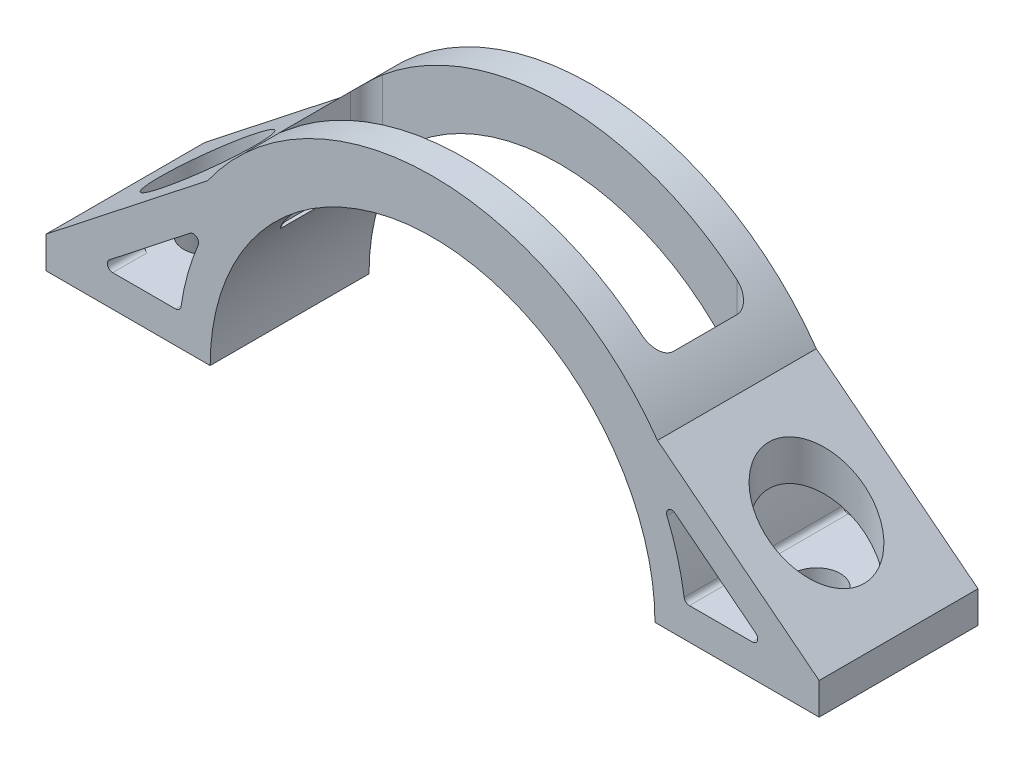
from build123d import *

# Parameters (mm, degrees)
SALIENTE_EXTRUIR1_DEPTH = 7.5
SALIENTE_EXTRUIR2_DEPTH = 7.5
CROQUIS3_R              = 2.25
CORTAR_EXTRUIR1_DEPTH   = 46.436769251
CROQUIS4_R              = 4.5
CORTAR_EXTRUIR2_DEPTH   = 44.789268092
CORTAR_EXTRUIR3_DEPTH   = 48.257274572
CORTAR_EXTRUIR4_DEPTH   = 15


with BuildPart() as part:
    # Croquis1 → Saliente-Extruir1 (new, symmetric)
    with BuildSketch(Plane.XY):
        with BuildLine():
            Line((-26, 0), (-21, 0))
            ThreePointArc((-21, 0), (0, 21), (21, 0))
            Line((21, 0), (26, 0))
            ThreePointArc((26, 0), (0, 26), (-26, 0))
        make_face()
    extrude(amount=SALIENTE_EXTRUIR1_DEPTH, both=True)

    # Croquis2 → Saliente-Extruir2 (add, symmetric)
    with BuildSketch(Plane.XY):
        with BuildLine():
            Line((26, 0), (36.5, 0))
            Line((36.5, 0), (36.5, 3))
            Line((36.5, 3), (21.236760582, 15))
            ThreePointArc((21.236760582, 15), (24.78059498, 7.869060455), (26, 0))
        make_face()
    saliente_extruir2 = extrude(amount=SALIENTE_EXTRUIR2_DEPTH, both=True)

    # Croquis3 → Cortar-Extruir1 (cut, through all)
    with BuildSketch(Plane.XZ):
        with Locations(Location((28.75, 0, 0), (0, 0, 270))):
            Circle(CROQUIS3_R)
    cortar_extruir1 = extrude(amount=-CORTAR_EXTRUIR1_DEPTH, mode=Mode.SUBTRACT)

    # Croquis4 → Cortar-Extruir2 (cut, through all)
    with BuildSketch(Plane(origin=(0, 3, 0), x_dir=(-1, 0, 0), z_dir=(0, -1, 0))):
        with Locations(Location((-28.75, 0, 0), (0, 0, 90))):
            Circle(CROQUIS4_R)
    cortar_extruir2 = extrude(amount=-CORTAR_EXTRUIR2_DEPTH, mode=Mode.SUBTRACT)

    # Simetría1: Saliente-Extruir2 across plane
    add(saliente_extruir2.mirror(Plane(origin=(0, 0, 0), x_dir=(0, 0, 1), z_dir=(1, 0, 0))))

    # Croquis6 → Cortar-Extruir3 (cut, through all)
    with BuildSketch(Plane.XY.offset(7.5)):
        with BuildLine():
            Line((30.510170652, 3.893065888), (22.898948379, 9.877029369))
            ThreePointArc((22.898948379, 9.877029369), (22.28692582, 9.881701061), (22.128900164, 9.290413206))
            ThreePointArc((22.128900164, 9.290413206), (23.12783497, 6.411181608), (23.753839647, 3.428571429))
            ThreePointArc((23.753839647, 3.428571429), (23.921384471, 3.122035527), (24.248711306, 3))
            Line((24.248711306, 3), (30.201141191, 3))
            ThreePointArc((30.201141191, 3), (30.673652007, 3.336496092), (30.510170652, 3.893065888))
        make_face()
    cortar_extruir3 = extrude(amount=-CORTAR_EXTRUIR3_DEPTH, mode=Mode.SUBTRACT)

    # Croquis8 → Cortar-Extruir4 (cut)
    with BuildSketch(Plane(origin=(0, 26, 0), x_dir=(1, 0, 0), z_dir=(0, 1, 0))):
        with BuildLine():
            Line((-16.736760582, -4.5), (16.736760582, -4.5))
            ThreePointArc((16.736760582, -4.5), (17.797420753, -4.060660172), (18.236760582, -3))
            Line((18.236760582, -3), (18.236760582, 3))
            ThreePointArc((18.236760582, 3), (17.797420753, 4.060660172), (16.736760582, 4.5))
            Line((16.736760582, 4.5), (-16.736760582, 4.5))
            ThreePointArc((-16.736760582, 4.5), (-17.797420753, 4.060660172), (-18.236760582, 3))
            Line((-18.236760582, 3), (-18.236760582, -3))
            ThreePointArc((-18.236760582, -3), (-17.797420753, -4.060660172), (-16.736760582, -4.5))
        make_face()
    extrude(amount=-CORTAR_EXTRUIR4_DEPTH, mode=Mode.SUBTRACT)

    # Simetría2: Cortar-Extruir1, Cortar-Extruir2, Cortar-Extruir3 across plane
    add(cortar_extruir1.mirror(Plane(origin=(0, 0, 0), x_dir=(0, 0, 1), z_dir=(1, 0, 0))), mode=Mode.SUBTRACT)
    add(cortar_extruir2.mirror(Plane(origin=(0, 0, 0), x_dir=(0, 0, 1), z_dir=(1, 0, 0))), mode=Mode.SUBTRACT)
    add(cortar_extruir3.mirror(Plane(origin=(0, 0, 0), x_dir=(0, 0, 1), z_dir=(1, 0, 0))), mode=Mode.SUBTRACT)


solid = part.part
